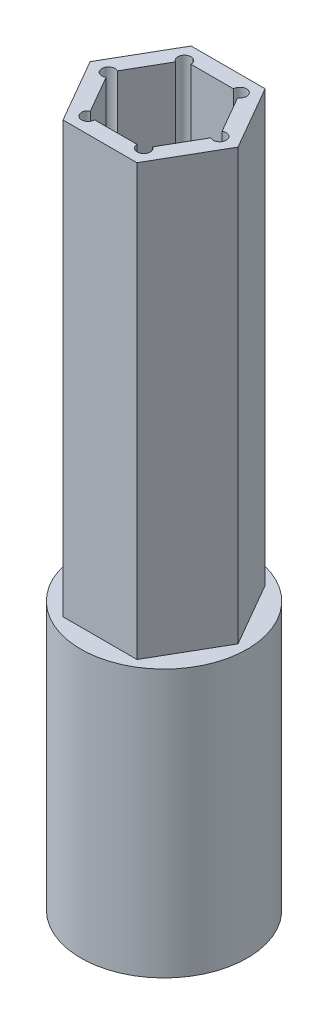
from build123d import *

# Parameters (mm, degrees)
BOSS_EXTRUDE1_DEPTH     = 23
SKETCH2_R               = 4.45
BOSS_EXTRUDE2_DEPTH     = 14.3
CUT_EXTRUDE1_DEPTH      = 38.827172773
CUT_EXTRUDE1_DEPTH_BACK = 38.827172773
SKETCH4_R               = 0.35


with BuildPart() as part:
    # Sketch1 → Boss-Extrude1 (new body)
    with BuildSketch(Plane(origin=(0, 0, 0), x_dir=(1, 0, 0), z_dir=(0, 1, 0))):
        Polygon((1.977424672, 3.425), (-1.977424672, 3.425), (-3.954849344, 0), (-1.977424672, -3.425), (1.977424672, -3.425), (3.954849344, 0), align=None)
        Polygon((2.973353886, 0), (1.486676943, 2.575), (-1.486676943, 2.575), (-2.973353886, 0), (-1.486676943, -2.575), (1.486676943, -2.575), align=None, mode=Mode.SUBTRACT)
    extrude(amount=BOSS_EXTRUDE1_DEPTH)

    # Sketch2 → Boss-Extrude2 (add)
    with BuildSketch(Plane.XZ):
        with Locations(Location((0, 0, 0), (0, 0, 270))):
            Circle(SKETCH2_R)
        Polygon((2.973353886, 0), (1.486676943, 2.575), (-1.486676943, 2.575), (-2.973353886, 0), (-1.486676943, -2.575), (1.486676943, -2.575), align=None, mode=Mode.SUBTRACT)
    extrude(amount=BOSS_EXTRUDE2_DEPTH)

    # Sketch4 → Cut-Extrude1 (cut, two sides: drawn at the far end of the back side and taken through both)
    with BuildSketch(Plane(origin=(0, 23, 0), x_dir=(1, 0, 0), z_dir=(0, 1, 0)).offset(-CUT_EXTRUDE1_DEPTH_BACK)):
        with Locations((1.486676943, 2.575)):
            Circle(SKETCH4_R)
        with Locations((2.973353886, 0)):
            Circle(SKETCH4_R)
        with Locations((1.486676943, -2.575)):
            Circle(SKETCH4_R)
        with Locations((-1.486676943, -2.575)):
            Circle(SKETCH4_R)
        with Locations((-2.973353886, 0)):
            Circle(SKETCH4_R)
        with Locations((-1.486676943, 2.575)):
            Circle(SKETCH4_R)
    extrude(amount=CUT_EXTRUDE1_DEPTH + CUT_EXTRUDE1_DEPTH_BACK, mode=Mode.SUBTRACT)


solid = part.part
